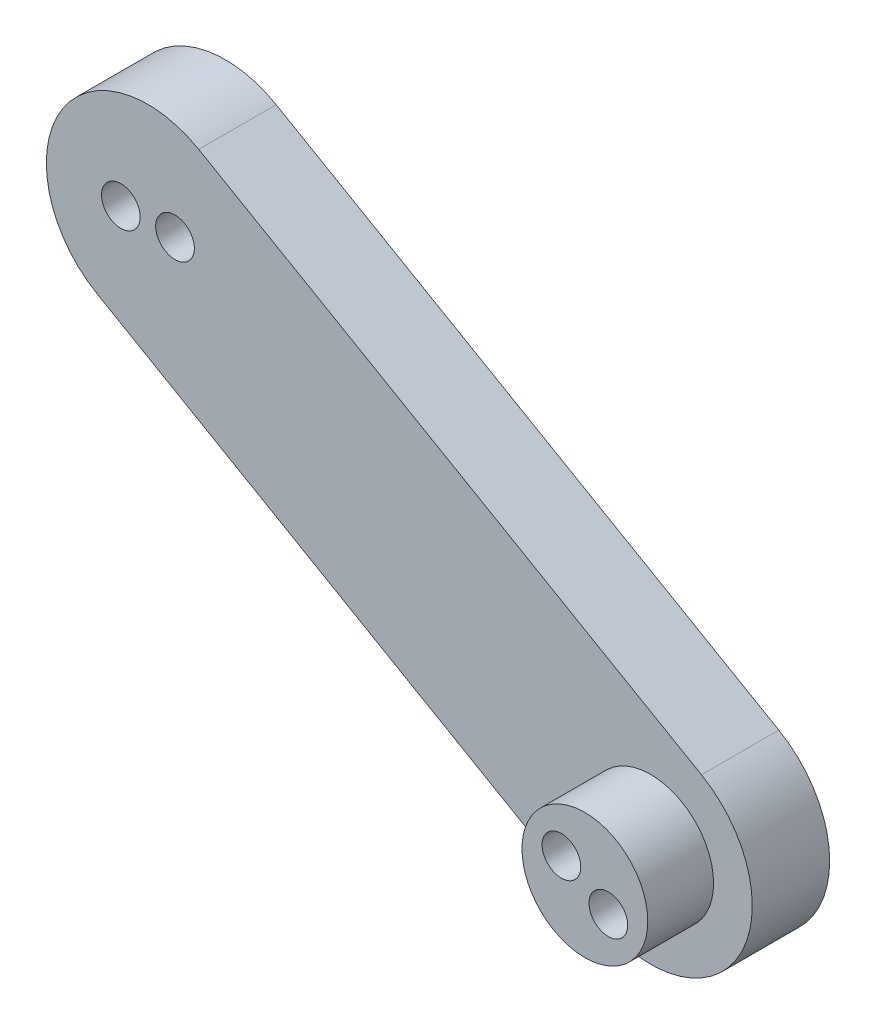
from build123d import *

# Parameters (mm, degrees)
LINK_SKETCH_R       = 1
LINK_EXTRUDE_DEPTH  = 4
JOINT_START         = 3.4
SKETCH1_3_R         = 3.25
SKETCH1_3_R_2       = 1
JOINT_EXTRUDE_DEPTH = 3.4


with BuildPart() as part:
    # Link Sketch → Link Extrude (new body)
    with BuildSketch(Plane.XY):
        with BuildLine():
            Line((-2.625, -4.54663337), (23.355762114, -19.54663337))
            ThreePointArc((23.355762114, -19.54663337), (30.527395483, -17.625), (28.605762114, -10.45336663))
            Line((28.605762114, -10.45336663), (2.625, 4.54663337))
            ThreePointArc((2.625, 4.54663337), (-4.54663337, 2.625), (-2.625, -4.54663337))
        make_face()
        with Locations((-1.4, 0)):
            Circle(LINK_SKETCH_R, mode=Mode.SUBTRACT)
        with Locations((1.4, 0)):
            Circle(LINK_SKETCH_R, mode=Mode.SUBTRACT)
        with Locations((27.193197679, -15.7)):
            Circle(LINK_SKETCH_R, mode=Mode.SUBTRACT)
        with Locations((24.768326548, -14.3)):
            Circle(LINK_SKETCH_R, mode=Mode.SUBTRACT)
    extrude(amount=-LINK_EXTRUDE_DEPTH)

    # Sketch1<3> → Joint Extrude (add)
    with BuildSketch(Plane.XY.offset(JOINT_START)):
        with Locations((25.980762114, -15)):
            Circle(SKETCH1_3_R)
        with Locations((24.768326548, -14.3)):
            Circle(SKETCH1_3_R_2, mode=Mode.SUBTRACT)
        with Locations((27.193197679, -15.7)):
            Circle(SKETCH1_3_R_2, mode=Mode.SUBTRACT)
    extrude(amount=-JOINT_EXTRUDE_DEPTH)


solid = part.part
